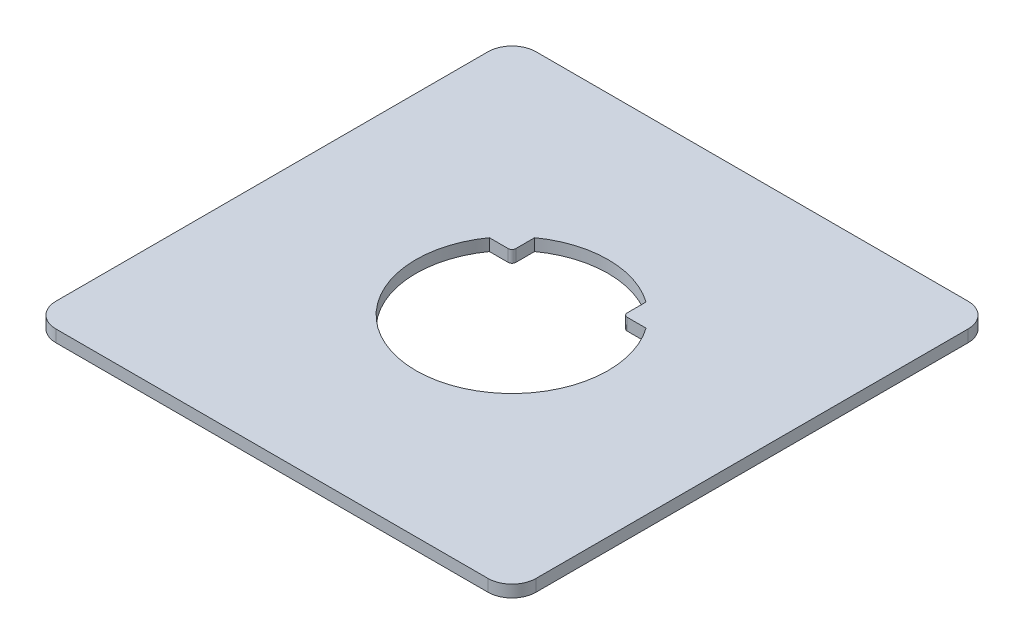
from build123d import *

# Parameters (mm, degrees)
SKETCH1_W           = 63.5
SKETCH1_H           = 63.5
BOSS_EXTRUDE1_DEPTH = 1.5875
FILLET1_R           = 0.508
FILLET2_R           = 3.175


with BuildPart() as part:
    # Sketch1 → Boss-Extrude1 (new body)
    with BuildSketch(Plane(origin=(0, 0, 0), x_dir=(1, 0, 0), z_dir=(0, 1, 0))):
        with Locations((31.75, 31.75)):
            Rectangle(SKETCH1_W, SKETCH1_H)
        with BuildLine():
            Line((24.384, 42.111215435), (24.384, 39.116))
            Line((24.384, 39.116), (21.388784565, 39.116))
            ThreePointArc((21.388784565, 39.116), (31.75, 19.0373), (42.111215435, 39.116))
            Line((42.111215435, 39.116), (39.116, 39.116))
            Line((39.116, 39.116), (39.116, 42.111215435))
            ThreePointArc((39.116, 42.111215435), (31.75, 44.4627), (24.384, 42.111215435))
        make_face(mode=Mode.SUBTRACT)
    extrude(amount=BOSS_EXTRUDE1_DEPTH)

    # Fillet1
    fillet1_edges = [part.edges().sort_by_distance(p)[0] for p in [
        (24.384, 0.79375, -39.116),
        (39.116, 0.79375, -39.116),
    ]]
    fillet(fillet1_edges, radius=FILLET1_R)

    # Fillet2
    fillet2_edges = [part.edges().sort_by_distance(p)[0] for p in [
        (0, 0.79375, -63.5),
        (63.5, 0.79375, -63.5),
        (63.5, 0.79375, 0),
        (0, 0.79375, 0),
    ]]
    fillet(fillet2_edges, radius=FILLET2_R)


solid = part.part
